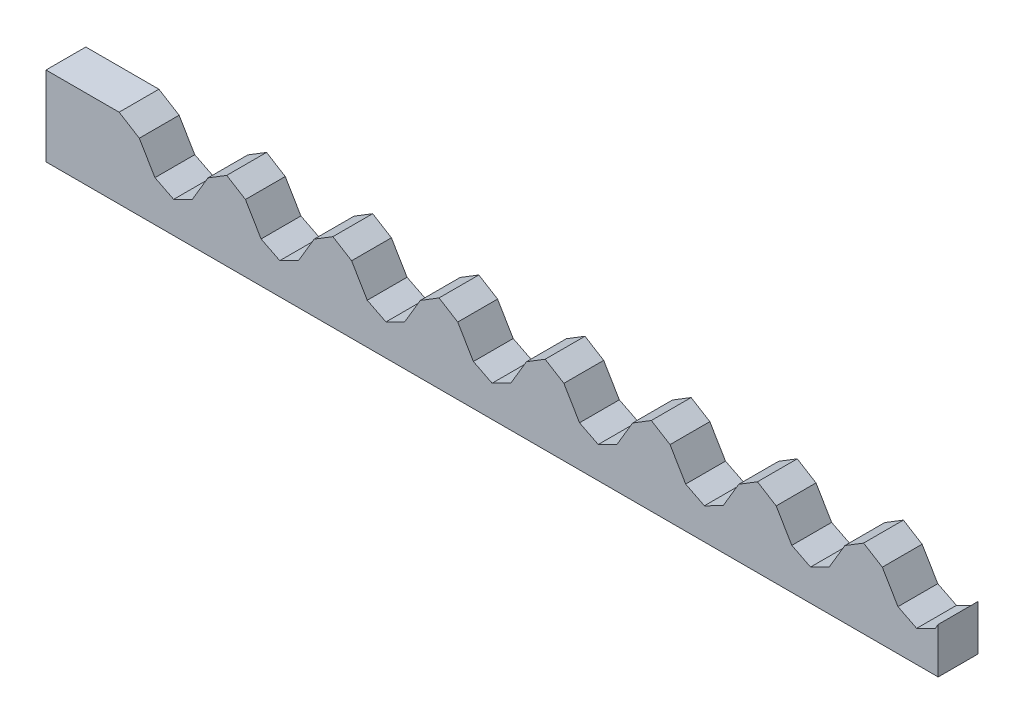
from build123d import *

# Parameters (mm, degrees)
SKETCH1_W            = 67.243323526
SKETCH1_H            = 6
BOSS_EXTRUDE1_DEPTH  = 3
CUT_EXTRUDE1_DEPTH   = 34.888289123
LPATTERN1_COUNT      = 4
LPATTERN1_PITCH      = 8
LPATTERN1_COUNT_DIR2 = 6
LPATTERN1_PITCH_DIR2 = 8


with BuildPart() as part:
    # Sketch1 → Boss-Extrude1 (new body)
    with BuildSketch(Plane.XY):
        Rectangle(SKETCH1_W, SKETCH1_H)
    extrude(amount=BOSS_EXTRUDE1_DEPTH)

    # Sketch2 → Cut-Extrude1 (cut, symmetric)
    with BuildSketch(Plane.XY):
        Polygon((0, -0.634469339), (-1.41026817, 0.075896996), (-2.589225858, 2.063475164), (-4.111542835, 3), (-4.981613855, 3.935817872), (0, 4.888597872), (4.981613855, 3.935817872), (4.111542835, 3), (2.589225858, 2.063475164), (1.41026817, 0.075896996), align=None)
    cut_extrude1 = extrude(amount=CUT_EXTRUDE1_DEPTH, both=True, mode=Mode.SUBTRACT)

    # LPattern1: Cut-Extrude1 4 × 6
    with Locations(*[Vector(-1, 0, 0) * (i * LPATTERN1_PITCH) + Vector(1, 0, 0) * (j * LPATTERN1_PITCH_DIR2) for i in range(LPATTERN1_COUNT) for j in range(LPATTERN1_COUNT_DIR2) if (i, j) != (0, 0)]):
        add(cut_extrude1, mode=Mode.SUBTRACT)


solid = part.part
